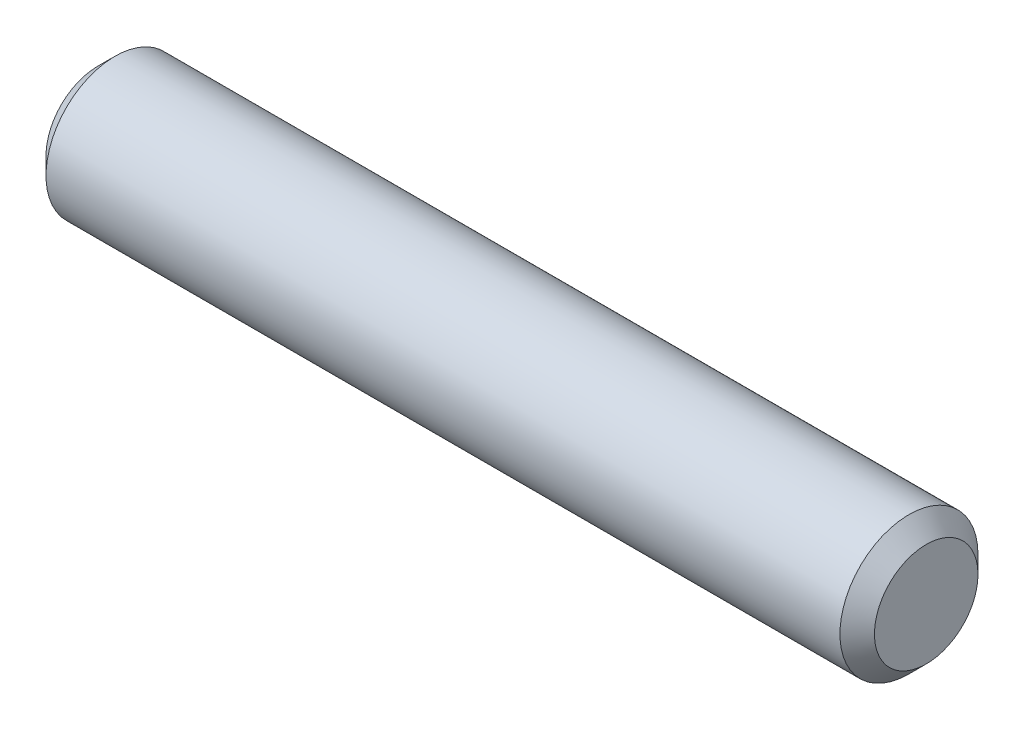
from build123d import *

# Parameters (mm, degrees)
ESQUISSE1_R        = 2
BOSS_EXTRU_1_DEPTH = 12
CHANFREIN1_SIZE    = 0.5


with BuildPart() as part:
    # Esquisse1 → Boss.-Extru.1 (new, symmetric)
    with BuildSketch(Plane(origin=(0, 0, 0), x_dir=(0, 0, -1), z_dir=(1, 0, 0))):
        Circle(ESQUISSE1_R)
    extrude(amount=BOSS_EXTRU_1_DEPTH, both=True)

    # Chanfrein1
    chanfrein1_edges = [part.edges().sort_by_distance(p)[0] for p in [
        (-12, 0, 2),
        (12, 0, 2),
    ]]
    chamfer(chanfrein1_edges, length=CHANFREIN1_SIZE)


solid = part.part
